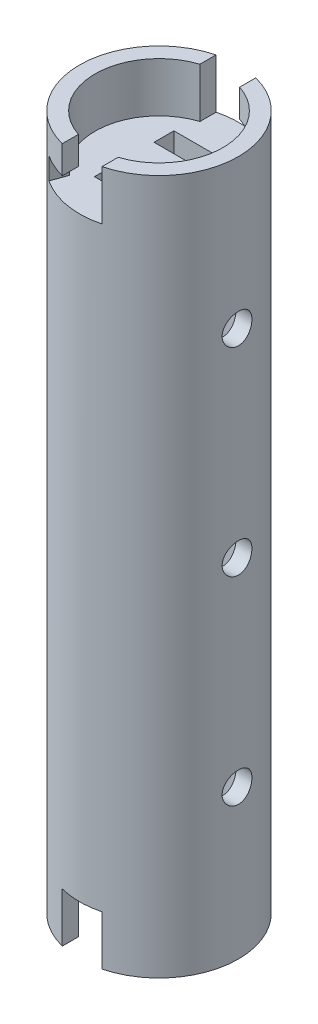
from build123d import *

# Parameters (mm, degrees)
SKETCH2_R                      = 10.16
SKETCH2_R_2                    = 8.1788
BOSS_EXTRUDE2_DEPTH            = 44.45
CUT_EXTRUDE1_DEPTH             = 6.35
CUT_EXTRUDE3_REACH             = 48.715
SKETCH5_R                      = 1.905
CUT_EXTRUDE3_DIRECTION_2_DEPTH = 13.97
CUT_EXTRUDE4_START             = -3.556
CUT_EXTRUDE4_DEPTH             = 2.794
BOSS_EXTRUDE3_START            = -2.54
SKETCH7_R                      = 8.1788
SKETCH7_W                      = 6.35
SKETCH7_H                      = 2.54
BOSS_EXTRUDE3_DEPTH            = 2.54


with BuildPart() as part:
    # Sketch2 → Boss-Extrude2 (new, symmetric)
    with BuildSketch(Plane(origin=(0, 0, 0), x_dir=(1, 0, 0), z_dir=(0, 1, 0))):
        with Locations(Location((0, 0, 0), (0, 0, 270))):
            Circle(SKETCH2_R)
        with Locations(Location((0, 0, 0), (0, 0, 270))):
            Circle(SKETCH2_R_2, mode=Mode.SUBTRACT)
    extrude(amount=BOSS_EXTRUDE2_DEPTH, both=True)

    # Sketch4 → Cut-Extrude1 (cut)
    with BuildSketch(Plane(origin=(0, 44.45, 0), x_dir=(1, 0, 0), z_dir=(0, 1, 0))):
        with BuildLine():
            Line((-2.54, 9.837377699), (-2.54, -9.837377699))
            ThreePointArc((-2.54, -9.837377699), (0, -10.16), (2.54, -9.837377699))
            Line((2.54, -9.837377699), (2.54, 9.837377699))
            ThreePointArc((2.54, 9.837377699), (0, 10.16), (-2.54, 9.837377699))
        make_face()
    cut_extrude1 = extrude(amount=-CUT_EXTRUDE1_DEPTH, mode=Mode.SUBTRACT)

    # Mirror1: Cut-Extrude1 across plane
    add(cut_extrude1.mirror(Plane.ZX), mode=Mode.SUBTRACT)

    # Sketch5 → Cut-Extrude3 (cut, up to next)
    with BuildSketch(Plane(origin=(0, 0, 0), x_dir=(0, 0, -1), z_dir=(1, 0, 0)), mode=Mode.PRIVATE) as cut_extrude3_sk1:
        with Locations(Location((0, 0, 0), (0, 0, 180))):
            Circle(SKETCH5_R)
    cut_extrude3_tool1 = extrude(cut_extrude3_sk1.sketch, amount=-CUT_EXTRUDE3_REACH, mode=Mode.PRIVATE) & part.part
    # Sketch5 → Cut-Extrude3 (cut, up to next)
    with BuildSketch(Plane(origin=(0, 0, 0), x_dir=(0, 0, -1), z_dir=(1, 0, 0)), mode=Mode.PRIVATE) as cut_extrude3_sk2:
        with Locations(Location((0, 25.4, 0), (0, 0, 180))):
            Circle(SKETCH5_R)
    cut_extrude3_tool2 = extrude(cut_extrude3_sk2.sketch, amount=-CUT_EXTRUDE3_REACH, mode=Mode.PRIVATE) & part.part
    # Sketch5 → Cut-Extrude3 (cut, up to next)
    with BuildSketch(Plane(origin=(0, 0, 0), x_dir=(0, 0, -1), z_dir=(1, 0, 0)), mode=Mode.PRIVATE) as cut_extrude3_sk3:
        with Locations((0, -25.4)):
            Circle(SKETCH5_R)
    cut_extrude3_tool3 = extrude(cut_extrude3_sk3.sketch, amount=-CUT_EXTRUDE3_REACH, mode=Mode.PRIVATE) & part.part
    add(cut_extrude3_tool1.solids().sort_by_distance((0, 0, 0))[0], mode=Mode.SUBTRACT)
    add(cut_extrude3_tool2.solids().sort_by_distance((0, 25.4, 0))[0], mode=Mode.SUBTRACT)
    add(cut_extrude3_tool3.solids().sort_by_distance((0, -25.4, 0))[0], mode=Mode.SUBTRACT)

    # Sketch5 → Cut-Extrude3 direction 2 (cut)
    with BuildSketch(Plane(origin=(0, 0, 0), x_dir=(0, 0, -1), z_dir=(1, 0, 0))):
        with Locations(Location((0, 0, 0), (0, 0, 180))):
            Circle(SKETCH5_R)
        with Locations(Location((0, 25.4, 0), (0, 0, 180))):
            Circle(SKETCH5_R)
        with Locations((0, -25.4)):
            Circle(SKETCH5_R)
    extrude(amount=CUT_EXTRUDE3_DIRECTION_2_DEPTH, mode=Mode.SUBTRACT)

    # Sketch6 → Cut-Extrude4 (cut)
    with BuildSketch(Plane(origin=(0, 44.45, 0), x_dir=(1, 0, 0), z_dir=(0, 1, 0)).offset(CUT_EXTRUDE4_START)):
        with BuildLine():
            Line((-4.918424262, -6.534666955), (-5.62055167, -8.463746152))
            ThreePointArc((-5.62055167, -8.463746152), (-4.137676497, -9.279290555), (-2.54, -9.837377699))
            Line((-2.54, -9.837377699), (-2.54, -7.774391902))
            ThreePointArc((-2.54, -7.774391902), (-3.78037731, -7.252690317), (-4.918424262, -6.534666955))
        make_face()
        with BuildLine():
            Line((2.54, 7.774391902), (2.54, 9.837377699))
            ThreePointArc((2.54, 9.837377699), (4.137676497, 9.279290555), (5.62055167, 8.463746152))
            Line((5.62055167, 8.463746152), (4.918424262, 6.534666955))
            ThreePointArc((4.918424262, 6.534666955), (3.78037731, 7.252690317), (2.54, 7.774391902))
        make_face()
    extrude(amount=-CUT_EXTRUDE4_DEPTH, mode=Mode.SUBTRACT)

    # Sketch7 → Boss-Extrude3 (add)
    with BuildSketch(Plane(origin=(0, 38.1, 0), x_dir=(1, 0, 0), z_dir=(0, 1, 0)).offset(BOSS_EXTRUDE3_START)):
        with Locations(Location((0, 0, 0), (0, 0, 71.907077979))):
            Circle(SKETCH7_R)
        with Locations((0, 3.81)):
            Rectangle(SKETCH7_W, SKETCH7_H, mode=Mode.SUBTRACT)
        with Locations((0, -3.81)):
            Rectangle(SKETCH7_W, SKETCH7_H, mode=Mode.SUBTRACT)
    extrude(amount=BOSS_EXTRUDE3_DEPTH)


solid = part.part
